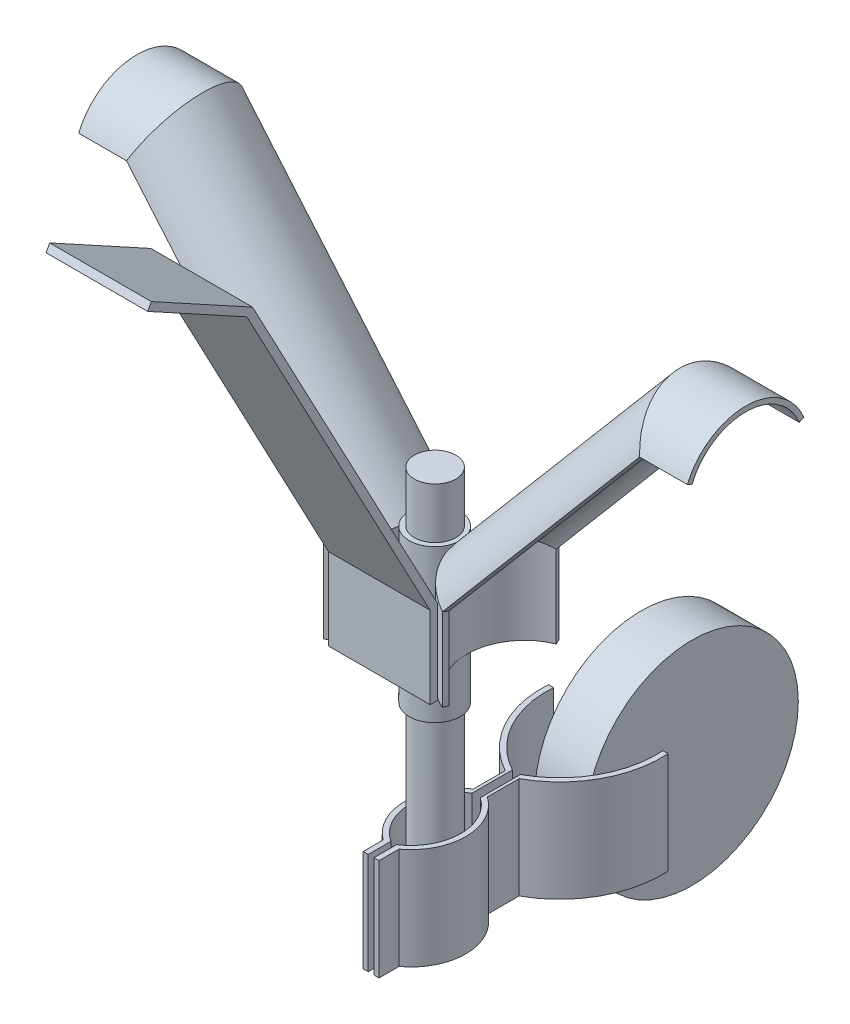
from build123d import *

# Parameters (mm, degrees)
EXTRUDE_THIN1_DEPTH      = 10
BOSS_EXTRUDE1_DEPTH      = 10
BOSS_EXTRUDE1_DEPTH_BACK = 20
SKETCH4_R                = 5
SKETCH4_R_2              = 4
BOSS_EXTRUDE2_DEPTH      = 10
BOSS_EXTRUDE2_DEPTH_BACK = 70
SKETCH5_R                = 4.081222788
BOSS_EXTRUDE3_DEPTH      = 20
BOSS_EXTRUDE3_2_DEPTH    = 20
SKETCH7_R                = 20.9280517
BOSS_EXTRUDE4_DEPTH      = 5


with BuildPart() as part:
    # Sweep1: sweep along a path in Sketch1
    with BuildLine(Plane(origin=(0, 0, 270), x_dir=(-1, 0, 0), z_dir=(0, 0, -1))) as sweep1_path:
        Line((-59.894009261, -72.5), (-47.400965294, -72.5))
        Line((-47.400965294, -72.5), (-5, -122.505789754))
        Line((-5, -122.505789754), (-5, -141.242131714))
    # Sketch2 → Sweep1 (sweep)
    with BuildSketch(Plane(origin=(59.894009261, -72.5, 270), x_dir=(0, 0, 1), z_dir=(-1, 0, 0))):
        with BuildLine():
            Line((-11.464548439, -6.671945539), (-10.540135636, -7.053338995))
            ThreePointArc((-10.540135636, -7.053338995), (0, 0), (10.540135636, -7.053338995))
            Line((10.540135636, -7.053338995), (11.464548439, -6.671945539))
            ThreePointArc((11.464548439, -6.671945539), (0, 1), (-11.464548439, -6.671945539))
        make_face()
    sweep1 = sweep(path=sweep1_path.line, transition=Transition.RIGHT)

    # Sketch4 → Boss-Extrude1 (add, two sides: drawn at the far end of the back side and taken through both)
    with BuildSketch(Plane.XZ.offset(141.242131714).offset(-BOSS_EXTRUDE1_DEPTH_BACK)):
        with Locations(Location((-2.881e-05, 271.307070621, 0), (0, 0, 270))):
            Circle(SKETCH4_R)
        with Locations(Location((-2.881e-05, 271.307070621, 0), (0, 0, 270))):
            Circle(SKETCH4_R_2, mode=Mode.SUBTRACT)
    extrude(amount=BOSS_EXTRUDE1_DEPTH + BOSS_EXTRUDE1_DEPTH_BACK)

    # Mirror1: Sweep1 across plane
    add(sweep1.mirror(Plane(origin=(0, 0, 0), x_dir=(0, 0, 1), z_dir=(1, 0, 0))))

    # Sketch5 → Boss-Extrude2 (add, two sides: drawn at the far end of the back side and taken through both)
    with BuildSketch(Plane(origin=(0, -121.242131714, 0), x_dir=(1, 0, 0), z_dir=(0, 1, 0)).offset(-BOSS_EXTRUDE2_DEPTH_BACK)):
        with Locations(Location((-2.881e-05, -271.225847833, 0), (0, 0, 270))):
            Circle(SKETCH5_R)
    extrude(amount=BOSS_EXTRUDE2_DEPTH + BOSS_EXTRUDE2_DEPTH_BACK)


with BuildPart() as body_2:
    # Sketch3 → Extrude-Thin1 (new, symmetric)
    with BuildSketch(Plane(origin=(0, 0, 0), x_dir=(0, 0, -1), z_dir=(1, 0, 0))):
        Polygon((-337.780615928, -46.440133469), (-318.276012784, -57.111844821), (-282.214548439, -125.14016423), (-282.214548439, -141.242131714), (-280.714548439, -141.242131714), (-280.714548439, -124.767175443), (-317.161393078, -56.011853562), (-337.060630928, -45.12422253), align=None)
    extrude(amount=EXTRUDE_THIN1_DEPTH, both=True)


with BuildPart() as body_3:
    # Sketch6 → Boss-Extrude3 (new body)
    with BuildSketch(Plane.XZ.offset(191.242131714)):
        with BuildLine():
            Line((-1.362886831, 262.304783722), (-1.362886831, 256.053891241))
            ThreePointArc((-1.362886831, 256.053891241), (-9.323537391, 248.120757478), (-11.768040707, 237.151209985))
            Line((-11.768040707, 237.151209985), (-10.768040707, 237.151209985))
            ThreePointArc((-10.768040707, 237.151209985), (-8.43097798, 247.653990229), (-0.792892656, 255.232242508))
            Line((-0.792892656, 255.232242508), (-0.792892656, 263.126432455))
            ThreePointArc((-0.792892656, 263.126432455), (-5.00002881, 271.307070621), (-0.560911528, 279.364183825))
            Line((-0.560911528, 279.364183825), (-0.560911528, 283.819636353))
            Line((-0.560911528, 283.819636353), (-1.560911528, 283.819636353))
            Line((-1.560911528, 283.819636353), (-1.560911528, 279.889060629))
            ThreePointArc((-1.560911528, 279.889060629), (-6.000343473, 271.045812649), (-1.362886831, 262.304783722))
        make_face()
    extrude(amount=-BOSS_EXTRUDE3_DEPTH)


with BuildPart() as body_4:
    # Sketch6 → Boss-Extrude3 2 (new body)
    with BuildSketch(Plane.XZ.offset(191.242131714)):
        with BuildLine():
            ThreePointArc((1.362829212, 256.053891241), (9.323479772, 248.120757478), (11.767983088, 237.151209985))
            Line((11.767983088, 237.151209985), (10.767983088, 237.151209985))
            ThreePointArc((10.767983088, 237.151209985), (8.430920361, 247.653990229), (0.792835037, 255.232242508))
            Line((0.792835037, 255.232242508), (0.792835037, 263.126432455))
            ThreePointArc((0.792835037, 263.126432455), (4.99997119, 271.307070621), (0.560853909, 279.364183825))
            Line((0.560853909, 279.364183825), (0.560853909, 283.819636353))
            Line((0.560853909, 283.819636353), (1.560853909, 283.819636353))
            Line((1.560853909, 283.819636353), (1.560853909, 279.889060629))
            ThreePointArc((1.560853909, 279.889060629), (6.000285854, 271.045812649), (1.362829212, 262.304783722))
            Line((1.362829212, 262.304783722), (1.362829212, 256.053891241))
        make_face()
    extrude(amount=-BOSS_EXTRUDE3_2_DEPTH)


with BuildPart() as body_5:
    # Sketch7 → Boss-Extrude4 (new, symmetric)
    with BuildSketch(Plane(origin=(0, 0, 0), x_dir=(0, 0, -1), z_dir=(1, 0, 0))):
        with Locations((-225.672454033, -181.930793774)):
            Circle(SKETCH7_R)
    extrude(amount=BOSS_EXTRUDE4_DEPTH, both=True)


solid = Compound([part.part, body_2.part, body_3.part, body_4.part, body_5.part])
